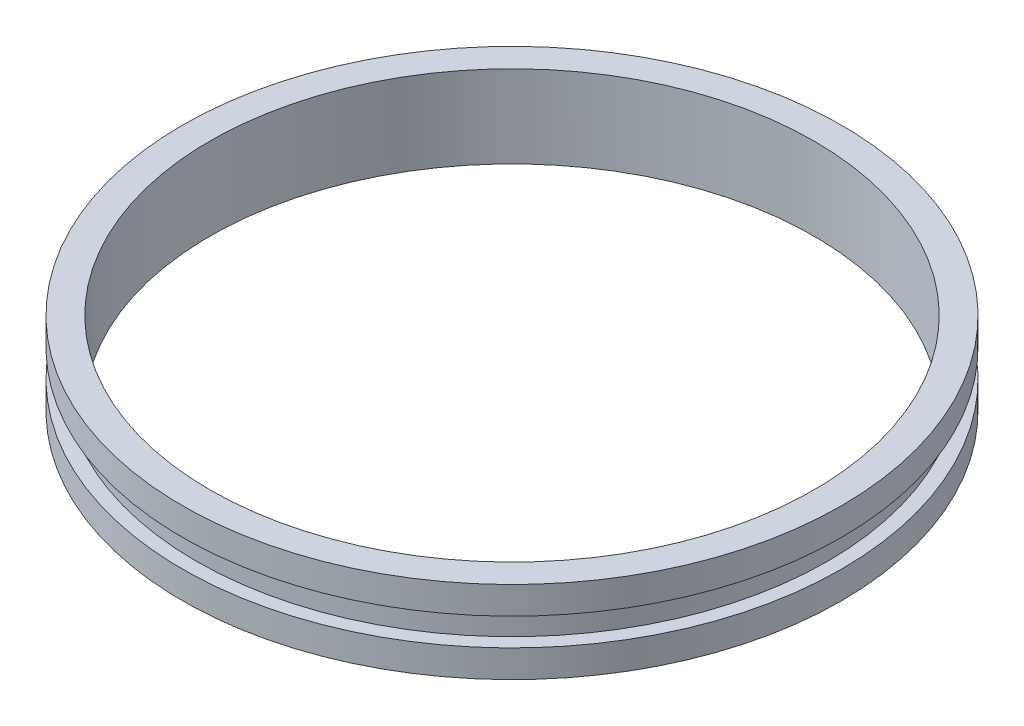
from build123d import *

# Parameters (mm, degrees)
CROQUIS1_R            = 5.5
CORTAR_EXTRUIR1_DEPTH = 10


with BuildPart() as part:
    # Croquis2 → Revolución1 (revolve)
    with BuildSketch(Plane.XY):
        Polygon((0, 0), (6, 0), (6, -0.5), (5.75, -0.5), (5.75, -1), (6, -1), (6, -1.5), (0, -1.5), align=None)
    revolve(axis=Axis((0, -1.5, 0), (0, 1, 0)))

    # Croquis1 → Cortar-Extruir1 (cut)
    with BuildSketch(Plane(origin=(0, 0, 0), x_dir=(1, 0, 0), z_dir=(0, 1, 0))):
        with Locations(Location((0, 0, 0), (0, 0, 270))):
            Circle(CROQUIS1_R)
    extrude(amount=-CORTAR_EXTRUIR1_DEPTH, mode=Mode.SUBTRACT)


solid = part.part
